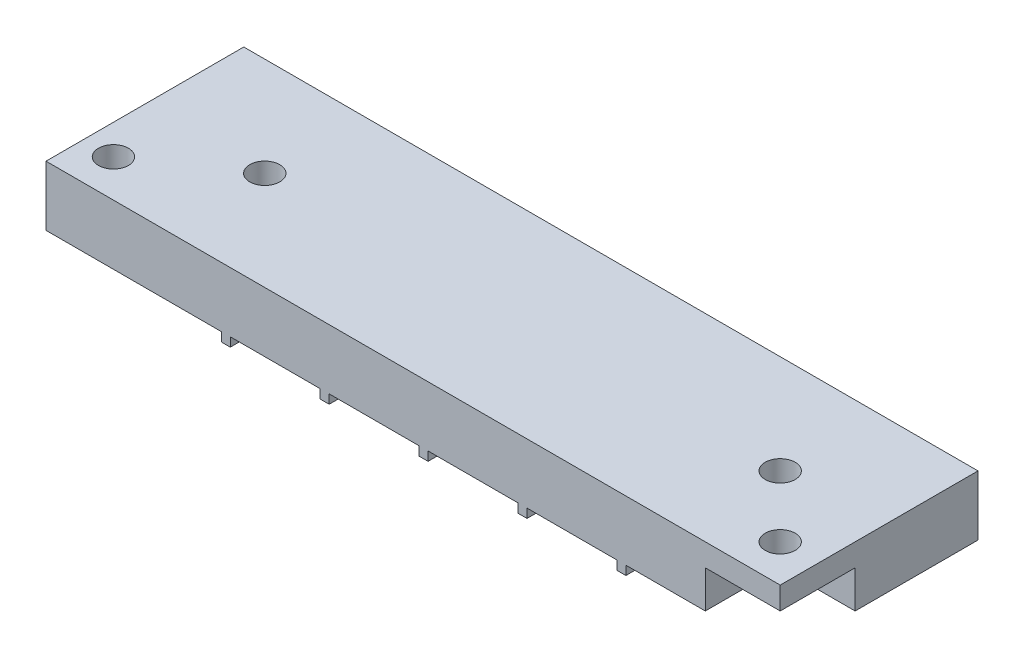
from build123d import *

# Parameters (mm, degrees)
SKETCH_1_R           = 1.25
EXTRUDE_1_DEPTH      = 2.5
SKETCH_2_W           = 82
SKETCH_2_H           = 7
CUT_EXTRUDE_1_DEPTH  = 2.5
SKETCH_3_W           = 79
SKETCH_3_H           = 4
EXTRUDE_2_DEPTH      = 10.7
SKETCH_4_W           = 0.6
SKETCH_4_H           = 13.2
EXTRUDE_3_DEPTH      = 0.6
SKETCH_5_W           = 6
SKETCH_5_H           = 0.4
EXTRUDE_4_DEPTH      = 0.4
SKETCH_11_R          = 1
CUT_EXTRUDE_5_DEPTH  = 5
SKETCH_12_W          = 8
SKETCH_12_H          = 6.68793424
EXTRUDE_6_DEPTH      = 5.9
SKETCH_13_R          = 1
CUT_EXTRUDE_6_DEPTH  = 8
SKETCH_15_W          = 8
SKETCH_15_H          = 5.9
CUT_EXTRUDE_11_DEPTH = 5
CUT_EXTRUDE_12_DEPTH = 5
SKETCH_17_W          = 4.18793424
SKETCH_17_H          = 5.9
CUT_EXTRUDE_13_DEPTH = 15
SKETCH_18_W          = 13.2
SKETCH_18_H          = 4
CUT_EXTRUDE_14_DEPTH = 2.5
SKETCH_19_W          = 13.2
SKETCH_19_H          = 4
CUT_EXTRUDE_15_DEPTH = 2.5
SKETCH_21_R          = 1
CUT_EXTRUDE_16_DEPTH = 10
SKETCH_22_W          = 5
SKETCH_22_H          = 5
CUT_EXTRUDE_17_DEPTH = 2.5
SKETCH_23_W          = 13.2
SKETCH_23_H          = 4
CUT_EXTRUDE_18_DEPTH = 25
SKETCH_24_R          = 1
CUT_EXTRUDE_19_DEPTH = 25


with BuildPart() as part:
    # 스케치1 → 보스-돌출1 (new body)
    with BuildSketch(Plane.XY):
        with BuildLine():
            Line((0, 8.45), (110, 8.45))
            Line((110, 8.45), (110, -8.45))
            Line((110, -8.45), (0, -8.45))
            ThreePointArc((0, -8.45), (-8.45, 0), (0, 8.45))
        make_face()
        with Locations((-5.95, 0)):
            Circle(SKETCH_1_R, mode=Mode.SUBTRACT)
        with Locations((0, 5.95)):
            Circle(SKETCH_1_R, mode=Mode.SUBTRACT)
        with Locations((5.95, 0)):
            Circle(SKETCH_1_R, mode=Mode.SUBTRACT)
        with Locations((0, -5.95)):
            Circle(SKETCH_1_R, mode=Mode.SUBTRACT)
    extrude(amount=EXTRUDE_1_DEPTH)

    # 스케치2 → 컷-돌출1 (cut)
    with BuildSketch(Plane(origin=(0, 0, 0), x_dir=(-1, 0, 0), z_dir=(0, 0, -1))):
        with Locations((-69, -4.95)):
            Rectangle(SKETCH_2_W, SKETCH_2_H)
    extrude(amount=-CUT_EXTRUDE_1_DEPTH, mode=Mode.SUBTRACT)

    # 스케치3 → 보스-돌출2 (add)
    with BuildSketch(Plane(origin=(0, 0, 0), x_dir=(-1, 0, 0), z_dir=(0, 0, -1))):
        with Locations((-67.5, 0.55)):
            Rectangle(SKETCH_3_W, SKETCH_3_H)
    extrude(amount=EXTRUDE_2_DEPTH)

    # 스케치4 → 보스-돌출3 (add)
    with BuildSketch(Plane.XZ.offset(1.45)):
        with Locations((74.1, -4.1)):
            Rectangle(SKETCH_4_W, SKETCH_4_H)
        with Locations((67.5, -4.1)):
            Rectangle(SKETCH_4_W, SKETCH_4_H)
        with Locations((80.7, -4.1)):
            Rectangle(SKETCH_4_W, SKETCH_4_H)
        with Locations((87.3, -4.1)):
            Rectangle(SKETCH_4_W, SKETCH_4_H)
        with Locations((93.9, -4.1)):
            Rectangle(SKETCH_4_W, SKETCH_4_H)
    extrude(amount=EXTRUDE_3_DEPTH)

    # 스케치5 → 보스-돌출4 (add)
    with BuildSketch(Plane.XZ.offset(1.45)):
        with Locations((70.8, 0.95)):
            Rectangle(SKETCH_5_W, SKETCH_5_H)
        with Locations((70.8, -9.15)):
            Rectangle(SKETCH_5_W, SKETCH_5_H)
        with Locations((77.4, 0.95)):
            Rectangle(SKETCH_5_W, SKETCH_5_H)
        with Locations((77.4, -9.15)):
            Rectangle(SKETCH_5_W, SKETCH_5_H)
        with Locations((84, 0.95)):
            Rectangle(SKETCH_5_W, SKETCH_5_H)
        with Locations((84, -9.15)):
            Rectangle(SKETCH_5_W, SKETCH_5_H)
        with Locations((90.6, 0.95)):
            Rectangle(SKETCH_5_W, SKETCH_5_H)
        with Locations((90.6, -9.15)):
            Rectangle(SKETCH_5_W, SKETCH_5_H)
    extrude(amount=EXTRUDE_4_DEPTH)

    # 스케치11 → 컷-돌출5 (cut)
    with BuildSketch(Plane.XZ.offset(1.45)):
        with Locations(Location((102, 0, 0), (0, 0, 270))):
            Circle(SKETCH_11_R)
        with Locations(Location((33, 0, 0), (0, 0, 270))):
            Circle(SKETCH_11_R)
    extrude(amount=-CUT_EXTRUDE_5_DEPTH, mode=Mode.SUBTRACT)

    # 스케치12 → 보스-돌출6 (add)
    with BuildSketch(Plane(origin=(0, 2.55, 0), x_dir=(1, 0, 0), z_dir=(0, 1, 0))):
        with Locations((67.5, 3.34396712)):
            Rectangle(SKETCH_12_W, SKETCH_12_H)
    extrude(amount=EXTRUDE_6_DEPTH)

    # 스케치13 → 컷-돌출6 (cut)
    with BuildSketch(Plane(origin=(0, 0, -6.68793424), x_dir=(-1, 0, 0), z_dir=(0, 0, -1))):
        with Locations((-67.5, 4.55)):
            Circle(SKETCH_13_R)
    extrude(amount=-CUT_EXTRUDE_6_DEPTH, mode=Mode.SUBTRACT)

    # 스케치15 → 컷-돌출11 (cut)
    with BuildSketch(Plane.XY.offset(2.5)):
        with Locations((67.5, 5.5)):
            Rectangle(SKETCH_15_W, SKETCH_15_H)
    extrude(amount=-CUT_EXTRUDE_11_DEPTH, mode=Mode.SUBTRACT)

    # 스케치16 → 컷-돌출12 (cut)
    with BuildSketch(Plane(origin=(0, 0, 0), x_dir=(-1, 0, 0), z_dir=(0, 0, -1))):
        with BuildLine():
            Line((-28, -8.45), (0, -8.45))
            ThreePointArc((0, -8.45), (8.45, 0), (0, 8.45))
            Line((0, 8.45), (-63.5, 8.45))
            Line((-63.5, 8.45), (-63.5, 2.55))
            Line((-63.5, 2.55), (-28, 2.55))
            Line((-28, 2.55), (-28, -8.45))
        make_face()
        Polygon((-71.5, 2.55), (-71.5, 8.45), (-110, 8.45), (-110, -1.45), (-107, -1.45), (-107, 2.55), align=None)
    extrude(amount=-CUT_EXTRUDE_12_DEPTH, mode=Mode.SUBTRACT)

    # 스케치17 → 컷-돌출13 (cut)
    with BuildSketch(Plane.ZY.offset(-63.5)):
        with Locations((-4.59396712, 5.5)):
            Rectangle(SKETCH_17_W, SKETCH_17_H)
    extrude(amount=-CUT_EXTRUDE_13_DEPTH, mode=Mode.SUBTRACT)

    # 스케치18 → 컷-돌출14 (cut)
    with BuildSketch(Plane.ZY.offset(-28)):
        with Locations((-4.1, 0.55)):
            Rectangle(SKETCH_18_W, SKETCH_18_H)
    extrude(amount=-CUT_EXTRUDE_14_DEPTH, mode=Mode.SUBTRACT)

    # 스케치19 → 컷-돌출15 (cut)
    with BuildSketch(Plane(origin=(107, 0, 0), x_dir=(0, 0, -1), z_dir=(1, 0, 0))):
        with Locations((4.1, 0.55)):
            Rectangle(SKETCH_19_W, SKETCH_19_H)
    extrude(amount=-CUT_EXTRUDE_15_DEPTH, mode=Mode.SUBTRACT)

    # 스케치21 → 컷-돌출16 (cut)
    with BuildSketch(Plane.XZ.offset(2.05)):
        with Locations(Location((63.5, -4.1, 0), (0, 0, 270))):
            Circle(SKETCH_21_R)
        with Locations(Location((97.9, -4.1, 0), (0, 0, 270))):
            Circle(SKETCH_21_R)
    extrude(amount=-CUT_EXTRUDE_16_DEPTH, mode=Mode.SUBTRACT)

    # 스케치22 → 컷-돌출17 (cut)
    with BuildSketch(Plane.XZ.offset(1.45)):
        with Locations((102, 0)):
            Rectangle(SKETCH_22_W, SKETCH_22_H)
    extrude(amount=-CUT_EXTRUDE_17_DEPTH, mode=Mode.SUBTRACT)

    # 스케치23 → 컷-돌출18 (cut)
    with BuildSketch(Plane.ZY.offset(-30.5)):
        with Locations((-4.1, 0.55)):
            Rectangle(SKETCH_23_W, SKETCH_23_H)
    extrude(amount=-CUT_EXTRUDE_18_DEPTH, mode=Mode.SUBTRACT)

    # 스케치24 → 컷-돌출19 (cut)
    with BuildSketch(Plane.XZ.offset(1.45)):
        with Locations(Location((57.5, 0, 0), (0, 0, 270))):
            Circle(SKETCH_24_R)
    extrude(amount=-CUT_EXTRUDE_19_DEPTH, mode=Mode.SUBTRACT)


solid = part.part
